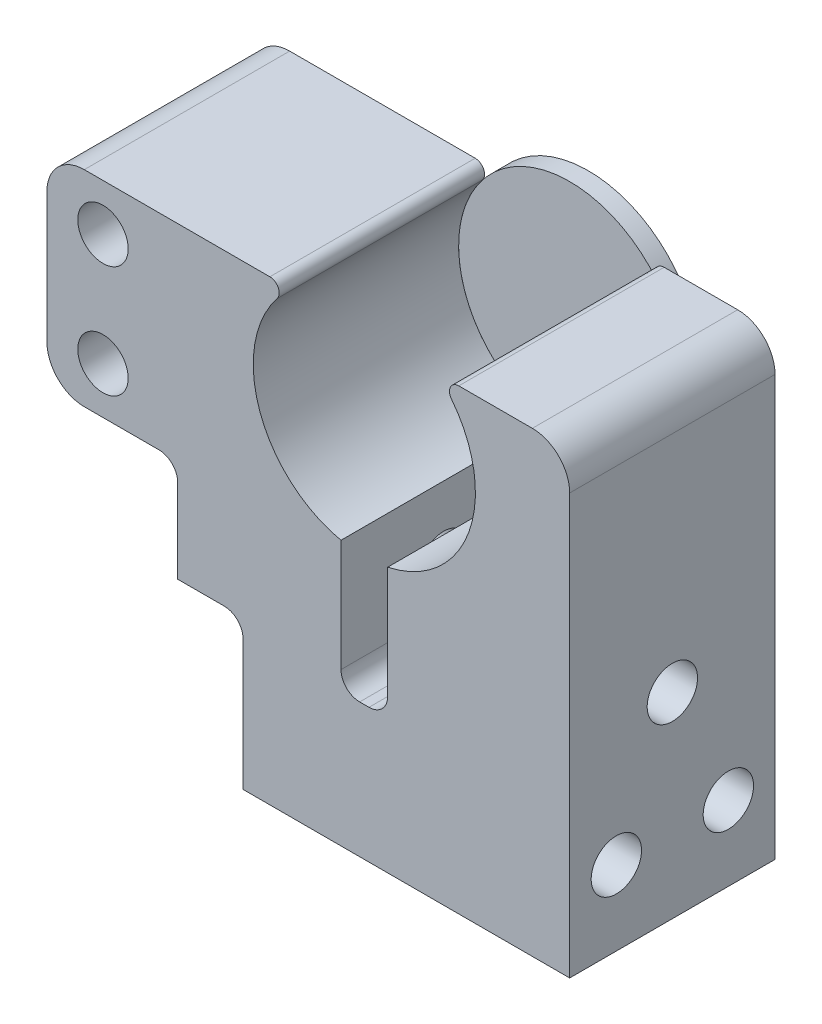
from build123d import *

# Parameters (mm, degrees)
EXTRUDE_1_DEPTH     = 11
SKETCH_6_W          = 2.5
SKETCH_6_H          = 7
CUT_EXTRUDE_2_DEPTH = 35.091787867
SKETCH_2_R          = 1.35
CUT_EXTRUDE_1_DEPTH = 35.091787867
SKETCH_9_R          = 1.35
CUT_EXTRUDE_3_DEPTH = 35.091787867
SKETCH_7_R          = 5.95
EXTRUDE_3_DEPTH     = 1
SKETCH_10_W         = 11
SKETCH_10_H         = 8
CUT_EXTRUDE_4_DEPTH = 3.5
FILLET_2_R          = 0.5
FILLET_1_R          = 2
FILLET_3_R          = 1


with BuildPart() as part:
    # 草图1 → 凸台-拉伸1 (new body)
    with BuildSketch(Plane.XY):
        with BuildLine():
            Line((0, 0), (21, 0))
            Line((21, 0), (21, 24.5))
            Line((21, 24.5), (13.892621225, 24.5))
            ThreePointArc((13.892621225, 24.5), (10, 14.05), (6.107378775, 24.5))
            Line((6.107378775, 24.5), (0, 24.5))
            Line((0, 24.5), (-7, 24.5))
            Line((-7, 24.5), (-7, 13.5))
            Line((-7, 13.5), (0, 13.5))
            Line((0, 13.5), (0, 0))
        make_face()
    extrude(amount=EXTRUDE_1_DEPTH)

    # 草图6 → 切除-拉伸2 (cut, through all)
    with BuildSketch(Plane.XY.offset(11)):
        with Locations((10, 10.682784171)):
            Rectangle(SKETCH_6_W, SKETCH_6_H)
    extrude(amount=-CUT_EXTRUDE_2_DEPTH, mode=Mode.SUBTRACT)

    # 草图2 → 切除-拉伸1 (cut, through all)
    with BuildSketch(Plane.ZY):
        with Locations((5.5, 10.5)):
            Circle(SKETCH_2_R)
        with Locations((8.5, 4)):
            Circle(SKETCH_2_R)
        with Locations((2.5, 4)):
            Circle(SKETCH_2_R)
    extrude(amount=-CUT_EXTRUDE_1_DEPTH, mode=Mode.SUBTRACT)

    # 草图9 → 切除-拉伸3 (cut, through all)
    with BuildSketch(Plane(origin=(0, 0, 0), x_dir=(-1, 0, 0), z_dir=(0, 0, -1))):
        with Locations((4, 22)):
            Circle(SKETCH_9_R)
        with Locations(Location((4, 16, 0), (0, 0, 180))):
            Circle(SKETCH_9_R)
    extrude(amount=-CUT_EXTRUDE_3_DEPTH, mode=Mode.SUBTRACT)

    # 草图10 → 切除-拉伸4 (cut)
    with BuildSketch(Plane.ZY):
        with Locations((5.5, 4)):
            Rectangle(SKETCH_10_W, SKETCH_10_H)
    extrude(amount=-CUT_EXTRUDE_4_DEPTH, mode=Mode.SUBTRACT)

    # 圆角2
    fillet_2_edges = [part.edges().sort_by_distance(p)[0] for p in [
        (6.107378775, 24.5, 5.5),
        (13.892621225, 24.5, 5.5),
    ]]
    fillet(fillet_2_edges, radius=FILLET_2_R)

    # 圆角1
    fillet_1_edges = [part.edges().sort_by_distance(p)[0] for p in [
        (-7, 13.5, 5.5),
        (-7, 24.5, 5.5),
        (21, 24.5, 5.5),
    ]]
    fillet(fillet_1_edges, radius=FILLET_1_R)

    # 圆角3
    fillet_3_edges = [part.edges().sort_by_distance(p)[0] for p in [
        (0, 13.5, 5.5),
        (11.25, 7.182784171, 5.5),
        (8.75, 7.182784171, 5.5),
        (3.5, 8, 5.5),
    ]]
    fillet(fillet_3_edges, radius=FILLET_3_R)


with BuildPart() as body_2:
    # 草图7 → 凸台-拉伸3 (new body)
    with BuildSketch(Plane(origin=(0, 0, 0), x_dir=(-1, 0, 0), z_dir=(0, 0, -1))):
        with Locations((-10, 20)):
            Circle(SKETCH_7_R)
    extrude(amount=EXTRUDE_3_DEPTH)


solid = Compound([part.part, body_2.part])
